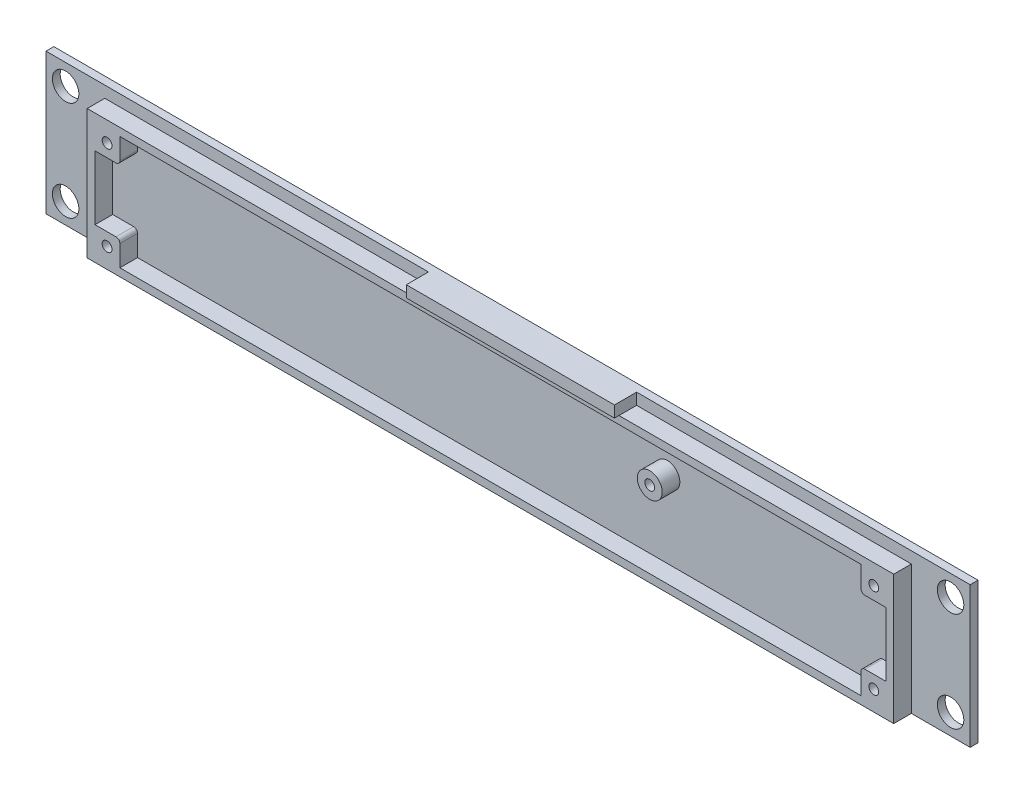
from build123d import *

# Parameters (mm, degrees)
SKETCH1_W                   = 205.74
SKETCH1_H                   = 33.02
SKETCH1_W_2                 = 201.74
SKETCH1_H_2                 = 29.02
SKETCH1_R                   = 3.175
BOSS_EXTRUDE1_DEPTH         = 4.5
TAP_DRILL_FOR_M3X0_5_TAP1_D = 2.5
SKETCH5_W                   = 235.74
SKETCH5_H                   = 35.94
BOSS_EXTRUDE2_DEPTH         = 2
SKETCH6_W                   = 53.1
SKETCH6_H                   = 2.92
BOSS_EXTRUDE3_DEPTH         = 5.65
F_1_4_CLEARANCE_HOLE1_D     = 6.7564


with BuildPart() as part:
    # Sketch1 → Boss-Extrude1 (new body)
    # profile 1 of 6: a face of its own
    with BuildSketch(Plane(origin=(0, 0, 143.199899198), x_dir=(-1, 0, 0), z_dir=(0, 0, -1))):
        with Locations((-78.001678372, 116.22318568)):
            Rectangle(SKETCH1_W, SKETCH1_H)
        with Locations((-78.001678372, 116.22318568)):
            Rectangle(SKETCH1_W_2, SKETCH1_H_2, mode=Mode.SUBTRACT)
    # profile 2 of 6: a face of its own
    with BuildSketch(Plane(origin=(0, 0, 143.199899198), x_dir=(-1, 0, 0), z_dir=(0, 0, -1))):
        with BuildLine():
            Line((16.518321628, 107.06318568), (16.518321628, 101.71318568))
            Line((16.518321628, 101.71318568), (22.868321628, 101.71318568))
            Line((22.868321628, 101.71318568), (22.868321628, 108.06318568))
            Line((22.868321628, 108.06318568), (17.518321628, 108.06318568))
            ThreePointArc((17.518321628, 108.06318568), (16.811214846, 107.770292461), (16.518321628, 107.06318568))
        make_face()
    # profile 3 of 6: a face of its own
    with BuildSketch(Plane(origin=(0, 0, 143.199899198), x_dir=(-1, 0, 0), z_dir=(0, 0, -1))):
        with BuildLine():
            Line((22.868321628, 130.73318568), (16.518321628, 130.73318568))
            Line((16.518321628, 130.73318568), (16.518321628, 125.38318568))
            ThreePointArc((16.518321628, 125.38318568), (16.811214846, 124.676078899), (17.518321628, 124.38318568))
            Line((17.518321628, 124.38318568), (22.868321628, 124.38318568))
            Line((22.868321628, 124.38318568), (22.868321628, 130.73318568))
        make_face()
    # profile 4 of 6: a face of its own
    with BuildSketch(Plane(origin=(0, 0, 143.199899198), x_dir=(-1, 0, 0), z_dir=(0, 0, -1))):
        with Locations((-118.641678372, 121.30318568)):
            Circle(SKETCH1_R)
    # profile 5 of 6: a face of its own
    with BuildSketch(Plane(origin=(0, 0, 143.199899198), x_dir=(-1, 0, 0), z_dir=(0, 0, -1))):
        with BuildLine():
            Line((-178.871678372, 130.73318568), (-178.871678372, 124.38318568))
            Line((-178.871678372, 124.38318568), (-173.521678372, 124.38318568))
            ThreePointArc((-173.521678372, 124.38318568), (-172.814571591, 124.676078899), (-172.521678372, 125.38318568))
            Line((-172.521678372, 125.38318568), (-172.521678372, 130.73318568))
            Line((-172.521678372, 130.73318568), (-178.871678372, 130.73318568))
        make_face()
    # profile 6 of 6: a face of its own
    with BuildSketch(Plane(origin=(0, 0, 143.199899198), x_dir=(-1, 0, 0), z_dir=(0, 0, -1))):
        with BuildLine():
            Line((-178.871678372, 108.06318568), (-178.871678372, 101.71318568))
            Line((-178.871678372, 101.71318568), (-172.521678372, 101.71318568))
            Line((-172.521678372, 101.71318568), (-172.521678372, 107.06318568))
            ThreePointArc((-172.521678372, 107.06318568), (-172.814571591, 107.770292461), (-173.521678372, 108.06318568))
            Line((-173.521678372, 108.06318568), (-178.871678372, 108.06318568))
        make_face()
    extrude(amount=BOSS_EXTRUDE1_DEPTH)

    # Tap Drill for M3x0.5 Tap1 (through all)
    with Locations(Plane.XY.offset(143.199899198)):
        with Locations((-19.788321628, 127.65318568), (-19.788321628, 104.79318568), (118.641678372, 121.30318568), (175.791678372, 127.65318568), (175.791678372, 104.79318568)):
            Hole(TAP_DRILL_FOR_M3X0_5_TAP1_D / 2)

    # Sketch5 → Boss-Extrude2 (add)
    with BuildSketch(Plane(origin=(0, 0, 138.699899198), x_dir=(-1, 0, 0), z_dir=(0, 0, -1))):
        with Locations((-78.001678372, 117.68318568)):
            Rectangle(SKETCH5_W, SKETCH5_H)
    extrude(amount=BOSS_EXTRUDE2_DEPTH)

    # Sketch6 → Boss-Extrude3 (add)
    with BuildSketch(Plane.XY.offset(138.699899198)):
        with Locations((84.241678372, 134.19318568)):
            Rectangle(SKETCH6_W, SKETCH6_H)
    extrude(amount=BOSS_EXTRUDE3_DEPTH)

    # 1/4 Clearance Hole1 (through all)
    with Locations(Plane.XY.offset(138.699899198)):
        with Locations((190.871678372, 104.98318568), (190.871678372, 130.38318568), (-34.868321628, 104.98318568), (-34.868321628, 130.38318568)):
            Hole(F_1_4_CLEARANCE_HOLE1_D / 2)


solid = part.part
